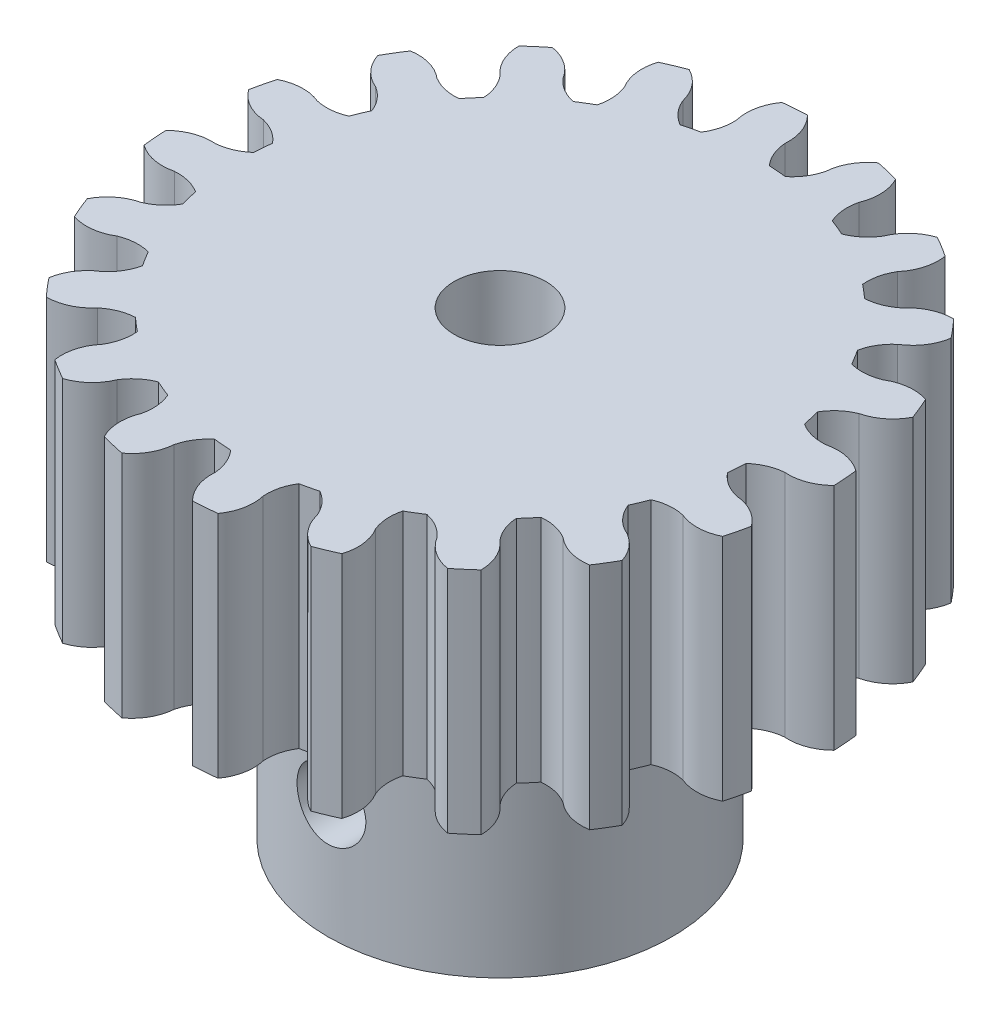
from build123d import *

# Parameters (mm, degrees)
SKETCH1_R               = 14
BOSS_EXTRUDE1_DEPTH     = 10
CUT_EXTRUDE3_DEPTH      = 18
CIRPATTERN2_COUNT       = 20
SKETCH4_R               = 2
CUT_EXTRUDE4_DEPTH      = 120
BOSS_EXTRUDE2_START     = 10
SKETCH5_R               = 7.5
SKETCH5_R_2             = 2
BOSS_EXTRUDE2_DEPTH     = 10
CUT_EXTRUDE5_DEPTH      = 21
CUT_EXTRUDE5_DEPTH_BACK = 21
SKETCH6_R               = 1.5


with BuildPart() as part:
    # Sketch1 → Boss-Extrude1 (new body)
    with BuildSketch(Plane(origin=(0, 0, 0), x_dir=(1, 0, 0), z_dir=(0, 1, 0))):
        Circle(SKETCH1_R)
    extrude(amount=BOSS_EXTRUDE1_DEPTH)

    # Sketch3 → Cut-Extrude3 (cut)
    with BuildSketch(Plane(origin=(0, 10, 0), x_dir=(1, 0, 0), z_dir=(0, 1, 0))):
        with BuildLine():
            ThreePointArc((2.880383473, 13.80265884), (1.107619796, 14.056428365), (-0.683011375, 14.08344757))
            ThreePointArc((-0.683011375, 14.08344757), (-0.143030934, 13.330902165), (0, 12.415781618))
            ThreePointArc((0, 12.415781618), (0.155194047, 11.785835551), (0.503865395, 11.238710765))
            ThreePointArc((0.503865395, 11.238710765), (0.883739199, 11.215235398), (1.262601532, 11.178923802))
            ThreePointArc((1.262601532, 11.178923802), (1.692662406, 11.664685971), (1.944605583, 12.2625504))
            ThreePointArc((1.944605583, 12.2625504), (2.229200839, 13.143974817), (2.880383473, 13.80265884))
        make_face()
    cut_extrude3 = extrude(amount=-CUT_EXTRUDE3_DEPTH, mode=Mode.SUBTRACT)

    # CirPattern2: Cut-Extrude3 ×20 about axis
    cirpattern2_axis = Axis((0, 10, 0), (0, 1, 0))
    for i in range(1, CIRPATTERN2_COUNT):
        add(cut_extrude3.rotate(cirpattern2_axis, i * 360 / CIRPATTERN2_COUNT), mode=Mode.SUBTRACT)

    # Sketch4 → Cut-Extrude4 (cut)
    with BuildSketch(Plane(origin=(0, 0, 0), x_dir=(-1, 0, 0), z_dir=(0, -1, 0))):
        Circle(SKETCH4_R)
    extrude(amount=-CUT_EXTRUDE4_DEPTH, mode=Mode.SUBTRACT)

    # Sketch5 → Boss-Extrude2 (add)
    with BuildSketch(Plane.XZ.offset(BOSS_EXTRUDE2_START)):
        Circle(SKETCH5_R)
        Circle(SKETCH5_R_2, mode=Mode.SUBTRACT)
    extrude(amount=-BOSS_EXTRUDE2_DEPTH)

    # Sketch6 → Cut-Extrude5 (cut, two sides: drawn at the far end of the back side and taken through both)
    with BuildSketch(Plane.XY.offset(-CUT_EXTRUDE5_DEPTH_BACK)):
        with Locations((0, -5)):
            Circle(SKETCH6_R)
    extrude(amount=CUT_EXTRUDE5_DEPTH + CUT_EXTRUDE5_DEPTH_BACK, mode=Mode.SUBTRACT)


solid = part.part
